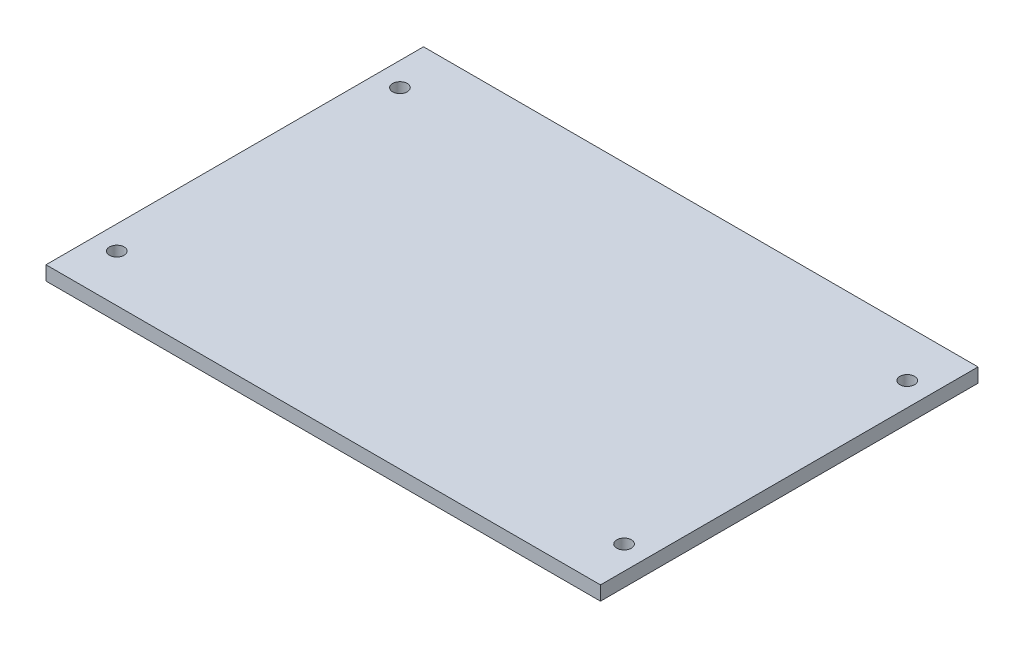
from build123d import *

# Parameters (mm, degrees)
SKETCH_1_W          = 117.5
SKETCH_1_H          = 3
EXTRUDE_1_DEPTH     = 80
CUT_EXTRUDE_1_REACH = 144.18
SKETCH_2_R          = 1.55


with BuildPart() as part:
    # 草图1 → 凸台-拉伸1 (new body)
    with BuildSketch(Plane.XY):
        with Locations((58.75, 1.5)):
            Rectangle(SKETCH_1_W, SKETCH_1_H)
    extrude(amount=EXTRUDE_1_DEPTH)

    # 草图2 → 切除-拉伸1 (cut, up to next)
    with BuildSketch(Plane(origin=(0, 3, 0), x_dir=(1, 0, 0), z_dir=(0, 1, 0)), mode=Mode.PRIVATE) as cut_extrude_1_sk1:
        with Locations(Location((5, -10, 0), (0, 0, 270))):
            Circle(SKETCH_2_R)
    cut_extrude_1_tool1 = extrude(cut_extrude_1_sk1.sketch, amount=-CUT_EXTRUDE_1_REACH, mode=Mode.PRIVATE) & part.part
    # 草图2 → 切除-拉伸1 (cut, up to next)
    with BuildSketch(Plane(origin=(0, 3, 0), x_dir=(1, 0, 0), z_dir=(0, 1, 0)), mode=Mode.PRIVATE) as cut_extrude_1_sk2:
        with Locations(Location((5, -70, 0), (0, 0, 270))):
            Circle(SKETCH_2_R)
    cut_extrude_1_tool2 = extrude(cut_extrude_1_sk2.sketch, amount=-CUT_EXTRUDE_1_REACH, mode=Mode.PRIVATE) & part.part
    # 草图2 → 切除-拉伸1 (cut, up to next)
    with BuildSketch(Plane(origin=(0, 3, 0), x_dir=(1, 0, 0), z_dir=(0, 1, 0)), mode=Mode.PRIVATE) as cut_extrude_1_sk3:
        with Locations(Location((112.5, -70, 0), (0, 0, 270))):
            Circle(SKETCH_2_R)
    cut_extrude_1_tool3 = extrude(cut_extrude_1_sk3.sketch, amount=-CUT_EXTRUDE_1_REACH, mode=Mode.PRIVATE) & part.part
    # 草图2 → 切除-拉伸1 (cut, up to next)
    with BuildSketch(Plane(origin=(0, 3, 0), x_dir=(1, 0, 0), z_dir=(0, 1, 0)), mode=Mode.PRIVATE) as cut_extrude_1_sk4:
        with Locations(Location((112.5, -10, 0), (0, 0, 270))):
            Circle(SKETCH_2_R)
    cut_extrude_1_tool4 = extrude(cut_extrude_1_sk4.sketch, amount=-CUT_EXTRUDE_1_REACH, mode=Mode.PRIVATE) & part.part
    add(cut_extrude_1_tool1.solids().sort_by_distance((5, 3, 10))[0], mode=Mode.SUBTRACT)
    add(cut_extrude_1_tool2.solids().sort_by_distance((5, 3, 70))[0], mode=Mode.SUBTRACT)
    add(cut_extrude_1_tool3.solids().sort_by_distance((112.5, 3, 70))[0], mode=Mode.SUBTRACT)
    add(cut_extrude_1_tool4.solids().sort_by_distance((112.5, 3, 10))[0], mode=Mode.SUBTRACT)


solid = part.part
